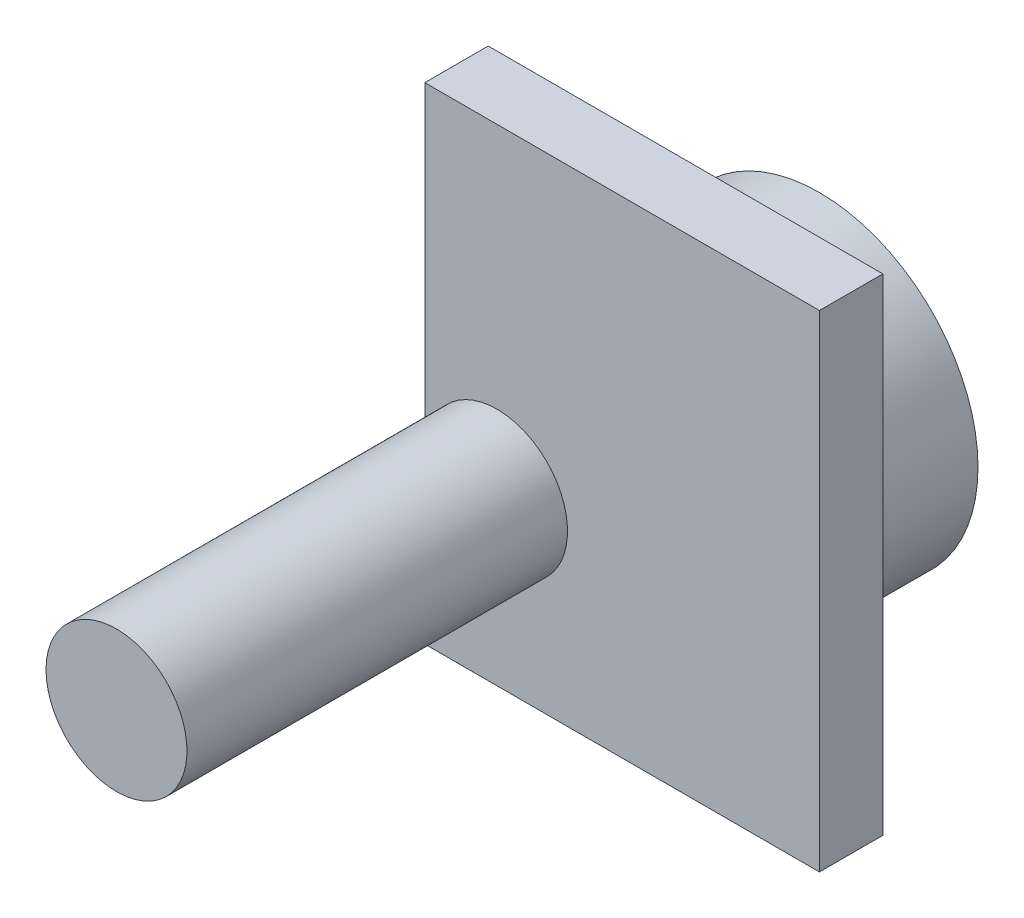
from build123d import *

# Parameters (mm, degrees)
SKETCH_1_R          = 4.5
EXTRUDE_1_DEPTH     = 4
SKETCH_2_W          = 11.2
SKETCH_2_H          = 13.8
EXTRUDE_2_DEPTH     = 1.8
CUT_EXTRUDE_1_DEPTH = 1
BLACK_DEPTH         = 1
SKETCH_4_R          = 2
EXTRUDE_3_DEPTH     = 10.8


with BuildPart() as part:
    # Эскиз1 → Бобышка-Вытянуть1 (new body)
    with BuildSketch(Plane.XY):
        Circle(SKETCH_1_R)
    extrude(amount=EXTRUDE_1_DEPTH)

    # Эскиз2 → Бобышка-Вытянуть2 (add)
    with BuildSketch(Plane.XY.offset(4)):
        with Locations((0.2, 0.5)):
            Rectangle(SKETCH_2_W, SKETCH_2_H)
    extrude(amount=EXTRUDE_2_DEPTH)

    # Эскиз3 → Вырез-Вытянуть1 (cut)
    with BuildSketch(Plane(origin=(0, 0, 0), x_dir=(-1, 0, 0), z_dir=(0, 0, -1))):
        Polygon((-3, -1.73), (3, -1.73), (0, 3.466152423), align=None)
    extrude(amount=-CUT_EXTRUDE_1_DEPTH, mode=Mode.SUBTRACT)

    # Эскиз4 → Бобышка-Вытянуть3 (add)
    with BuildSketch(Plane.XY.offset(5.8)):
        with Locations((-3.35, -1.6)):
            Circle(SKETCH_4_R)
    extrude(amount=EXTRUDE_3_DEPTH)


with BuildPart() as body_2:
    # Эскиз5 → black (new body)
    with BuildSketch(Plane(origin=(0, 0, 1), x_dir=(-1, 0, 0), z_dir=(0, 0, -1))):
        Polygon((0, 3.466152423), (-3, -1.73), (3, -1.73), align=None)
    extrude(amount=BLACK_DEPTH)


solid = Compound([part.part, body_2.part])
